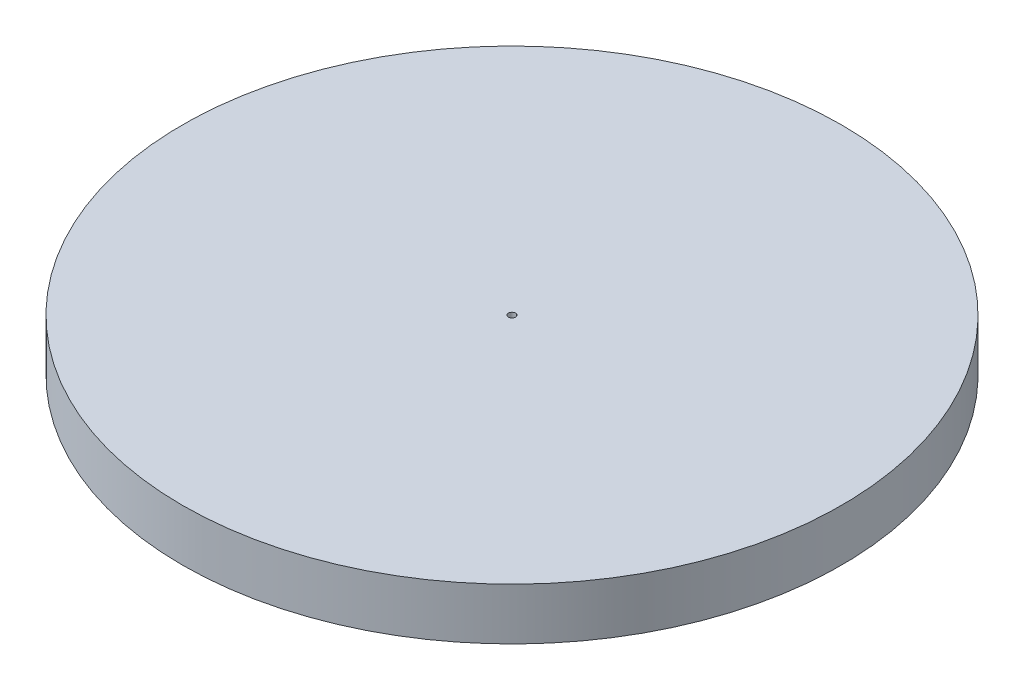
from build123d import *

# Parameters (mm, degrees)
SKETCH1_R           = 70
BOSS_EXTRUDE1_DEPTH = 11
CUT_EXTRUDE1_REACH  = 101.604
SKETCH3_R           = 0.75


with BuildPart() as part:
    # Sketch1 → Boss-Extrude1 (new body)
    with BuildSketch(Plane(origin=(0, 0, 0), x_dir=(1, 0, 0), z_dir=(0, 1, 0))):
        with Locations(Location((0, 0, 0), (0, 0, 270))):
            Circle(SKETCH1_R)
    extrude(amount=BOSS_EXTRUDE1_DEPTH)

    # Sketch3 → Cut-Extrude1 (cut, up to next)
    with BuildSketch(Plane(origin=(0, 11, 0), x_dir=(1, 0, 0), z_dir=(0, 1, 0)), mode=Mode.PRIVATE) as cut_extrude1_sk1:
        with Locations(Location((0, 0, 0), (0, 0, 270))):
            Circle(SKETCH3_R)
    cut_extrude1_tool1 = extrude(cut_extrude1_sk1.sketch, amount=-CUT_EXTRUDE1_REACH, mode=Mode.PRIVATE) & part.part
    add(cut_extrude1_tool1.solids().sort_by_distance((0, 11, 0))[0], mode=Mode.SUBTRACT)


solid = part.part
